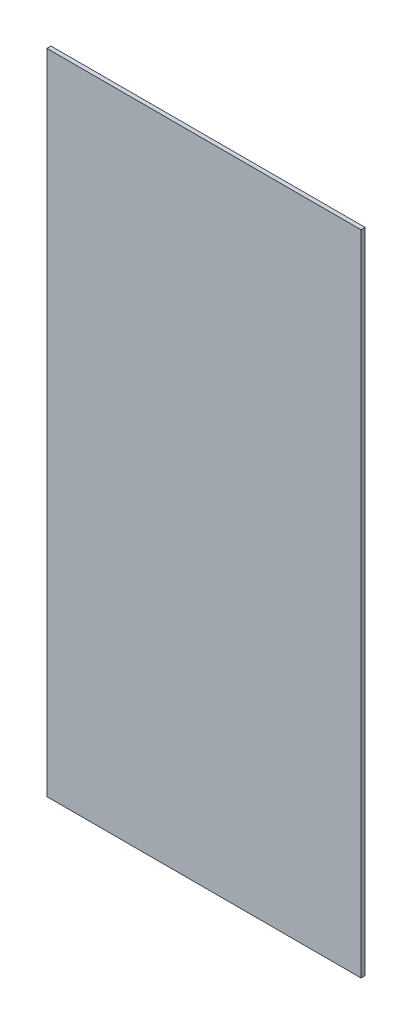
from build123d import *

# Parameters (mm, degrees)
SKETCH1_W           = 1219.2
SKETCH1_H           = 2514.6
BOSS_EXTRUDE1_DEPTH = 15.875


with BuildPart() as part:
    # Sketch1 → Boss-Extrude1 (new body)
    with BuildSketch(Plane.XY):
        with Locations((609.6, 1257.3)):
            Rectangle(SKETCH1_W, SKETCH1_H)
    extrude(amount=BOSS_EXTRUDE1_DEPTH)


solid = part.part
